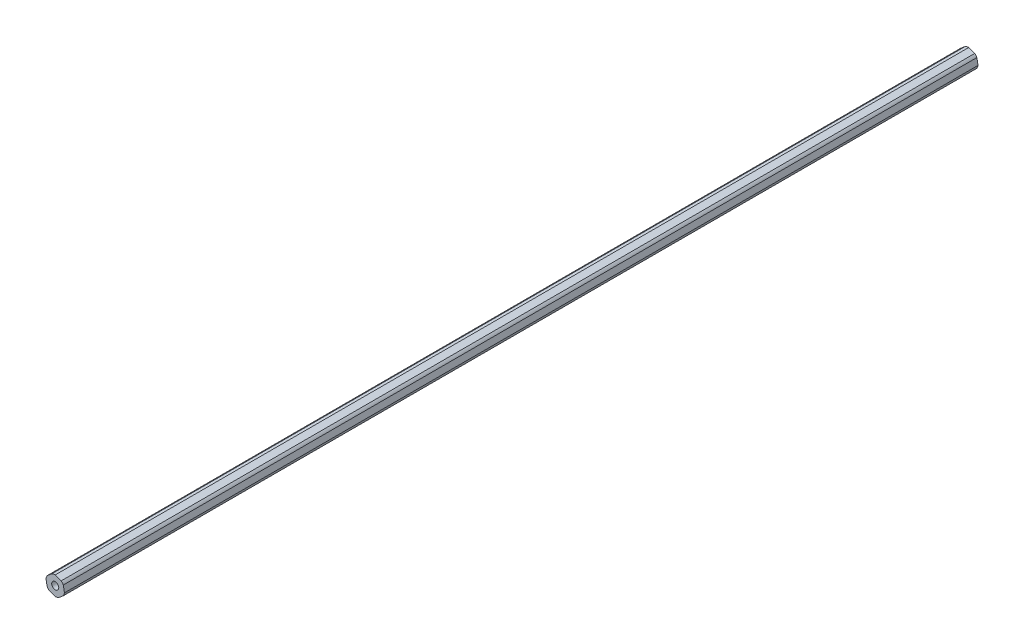
from build123d import *

# Parameters (mm, degrees)
BOSS_EXTRUDE1_DEPTH         = 658.9014
SKETCH2_R                   = 2.0193
CUT_EXTRUDE1_DEPTH          = 659.969574666
F_1_4_20_TAPPED_HOLE1_D     = 5.1054
F_1_4_20_TAPPED_HOLE1_DEPTH = 19.05
F_1_4_20_TAPPED_HOLE1_TIP   = 1.533816902
F_1_4_20_TAPPED_HOLE2_D     = 5.1054
F_1_4_20_TAPPED_HOLE2_DEPTH = 19.05
F_1_4_20_TAPPED_HOLE2_TIP   = 1.533816902


with BuildPart() as part:
    # Sketch1 → Boss-Extrude1 (new body)
    with BuildSketch(Plane.XY):
        with BuildLine():
            Line((-6.654540832, 1.131188008), (-5.845671476, -3.375))
            ThreePointArc((-5.845671476, -3.375), (-5.15742276, -4.354709), (-4.306907968, -5.197407407))
            Line((-4.306907968, -5.197407407), (0, -6.75))
            ThreePointArc((0, -6.75), (1.19257724, -6.643813628), (2.347632865, -6.328595415))
            Line((2.347632865, -6.328595415), (5.845671476, -3.375))
            ThreePointArc((5.845671476, -3.375), (6.35, -2.289104628), (6.654540832, -1.131188008))
            Line((6.654540832, -1.131188008), (5.845671476, 3.375))
            ThreePointArc((5.845671476, 3.375), (5.15742276, 4.354709), (4.306907968, 5.197407407))
            Line((4.306907968, 5.197407407), (0, 6.75))
            ThreePointArc((0, 6.75), (-1.19257724, 6.643813628), (-2.347632865, 6.328595415))
            Line((-2.347632865, 6.328595415), (-5.845671476, 3.375))
            ThreePointArc((-5.845671476, 3.375), (-6.35, 2.289104628), (-6.654540832, 1.131188008))
        make_face()
    extrude(amount=BOSS_EXTRUDE1_DEPTH)

    # Sketch2 → Cut-Extrude1 (cut, through all)
    with BuildSketch(Plane.XY.offset(658.9014)):
        Circle(SKETCH2_R)
    extrude(amount=-CUT_EXTRUDE1_DEPTH, mode=Mode.SUBTRACT)

    # 1/4-20 Tapped Hole1
    with Locations(Plane.XY.offset(658.9014)):
        with Locations((0, 0)):
            Hole(F_1_4_20_TAPPED_HOLE1_D / 2, depth=F_1_4_20_TAPPED_HOLE1_DEPTH)
            with Locations((0, 0, -(F_1_4_20_TAPPED_HOLE1_DEPTH + F_1_4_20_TAPPED_HOLE1_TIP / 2))):  # 118° drill point
                Cone(0, F_1_4_20_TAPPED_HOLE1_D / 2, F_1_4_20_TAPPED_HOLE1_TIP, mode=Mode.SUBTRACT)

    # 1/4-20 Tapped Hole2
    with Locations(Plane(origin=(0, 0, 0), x_dir=(-1, 0, 0), z_dir=(0, 0, -1))):
        with Locations((0, 0)):
            Hole(F_1_4_20_TAPPED_HOLE2_D / 2, depth=F_1_4_20_TAPPED_HOLE2_DEPTH)
            with Locations((0, 0, -(F_1_4_20_TAPPED_HOLE2_DEPTH + F_1_4_20_TAPPED_HOLE2_TIP / 2))):  # 118° drill point
                Cone(0, F_1_4_20_TAPPED_HOLE2_D / 2, F_1_4_20_TAPPED_HOLE2_TIP, mode=Mode.SUBTRACT)


solid = part.part
